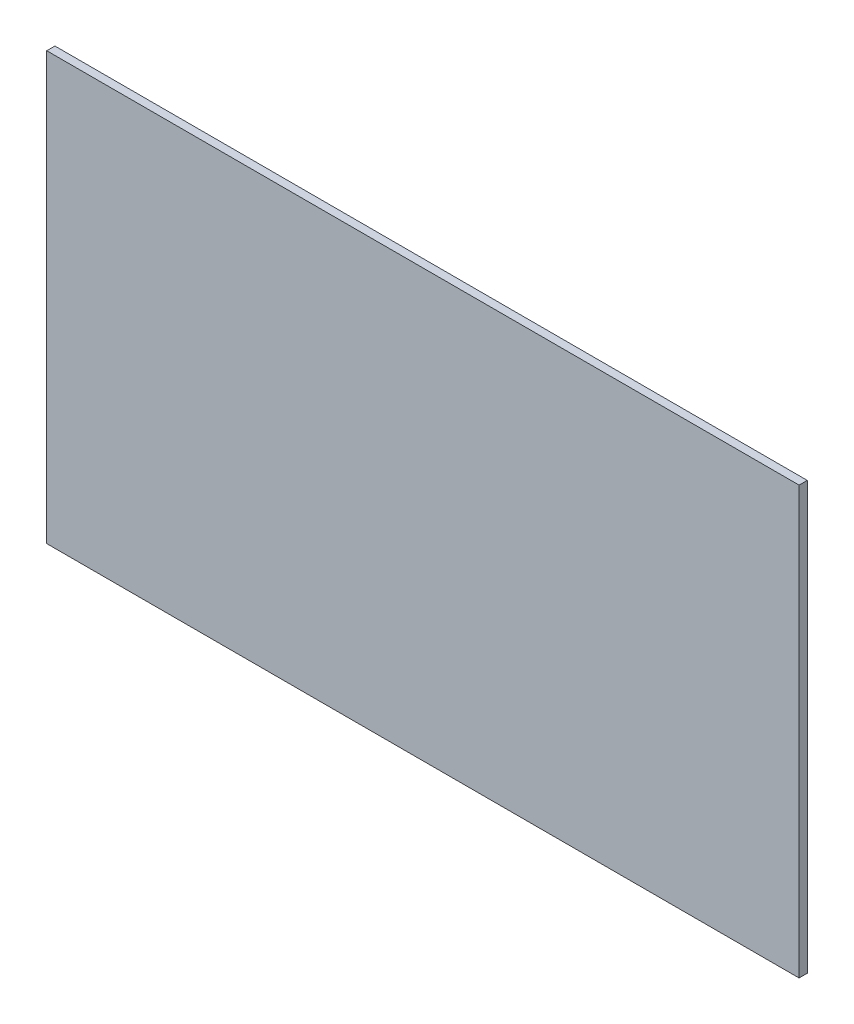
from build123d import *

# Parameters (mm, degrees)
SKETCH_1_W      = 460
SKETCH_1_H      = 261
EXTRUDE_1_DEPTH = 5


with BuildPart() as part:
    # 스케치1 → 보스-돌출1 (new body)
    with BuildSketch(Plane.XY):
        Rectangle(SKETCH_1_W, SKETCH_1_H)
    extrude(amount=EXTRUDE_1_DEPTH)


solid = part.part
